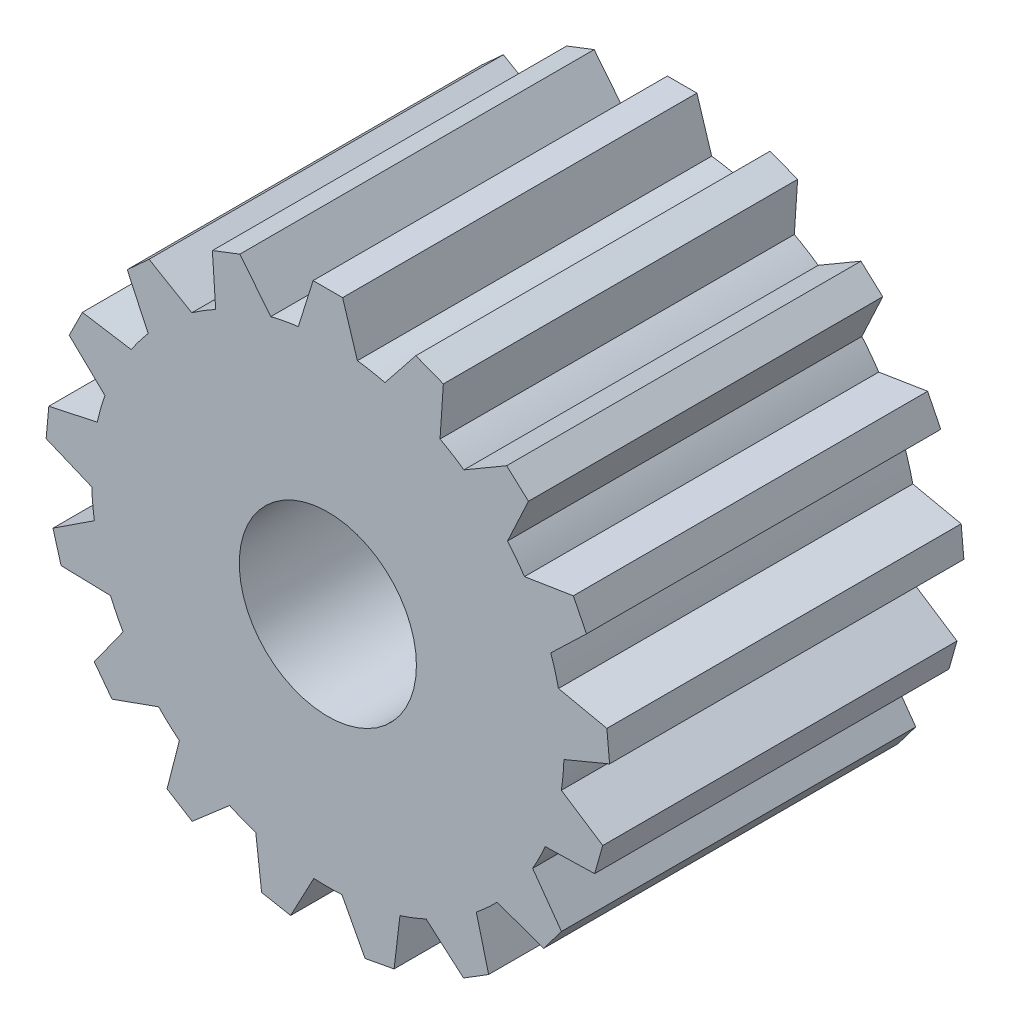
from build123d import *

# Parameters (mm, degrees)
SKETCH1_R           = 4
BOSS_EXTRUDE1_DEPTH = 6
BOSS_EXTRUDE2_DEPTH = 6
CIRPATTERN1_COUNT   = 17
SKETCH5_R           = 1.5
CUT_EXTRUDE1_DEPTH  = 6


with BuildPart() as part:
    # Sketch1 → Boss-Extrude1 (new body)
    with BuildSketch(Plane.XY):
        Circle(SKETCH1_R)
    extrude(amount=BOSS_EXTRUDE1_DEPTH)

    # Sketch3 → Boss-Extrude2 (add)
    with BuildSketch(Plane.XY):
        Polygon((0, 4.768626967), (0.25, 4.768626967), (0.5, 3.968626967), (-0.5, 3.968626967), (-0.25, 4.768626967), align=None)
    boss_extrude2 = extrude(amount=BOSS_EXTRUDE2_DEPTH)

    # CirPattern1: Boss-Extrude2 ×17 about axis
    cirpattern1_axis = Axis((0, 0, 0), (0, 0, 1))
    for i in range(1, CIRPATTERN1_COUNT):
        add(boss_extrude2.rotate(cirpattern1_axis, i * 360 / CIRPATTERN1_COUNT))

    # Sketch5 → Cut-Extrude1 (cut)
    with BuildSketch(Plane.XY):
        Circle(SKETCH5_R)
    extrude(amount=CUT_EXTRUDE1_DEPTH, mode=Mode.SUBTRACT)


solid = part.part
